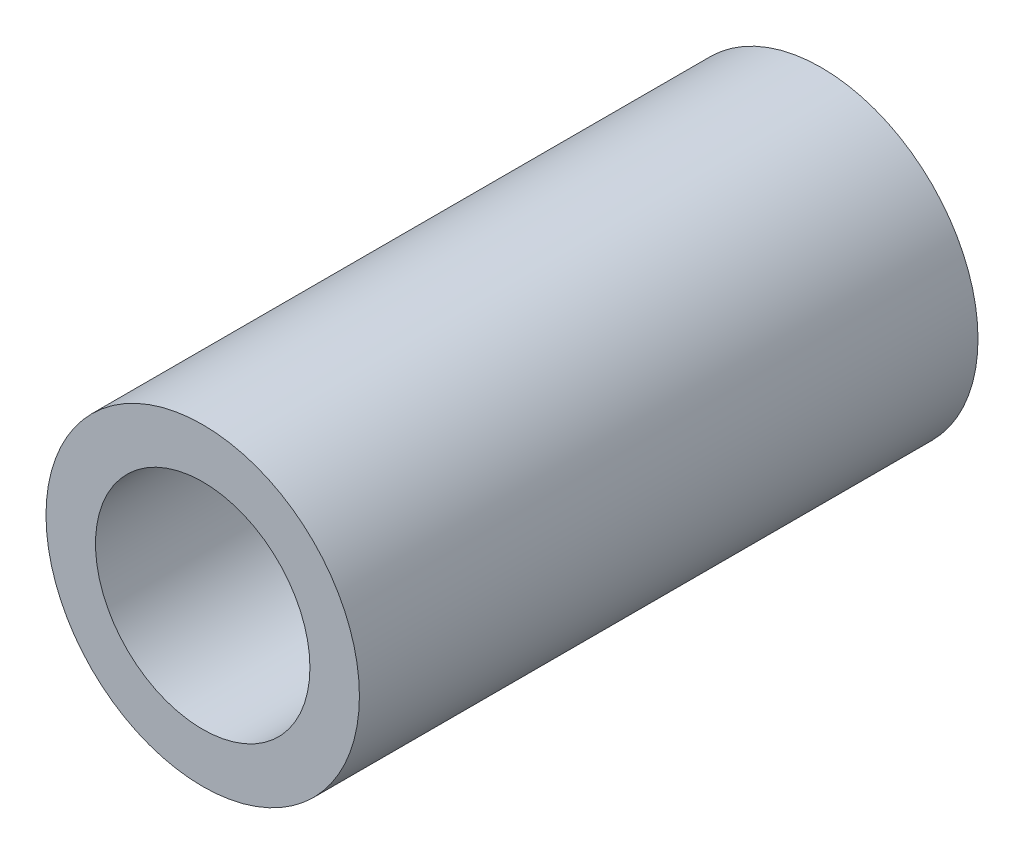
from build123d import *

# Parameters (mm, degrees)
CROQUIS1_R              = 3.8
CROQUIS1_R_2            = 2.6
SALIENTE_EXTRUIR1_DEPTH = 15


with BuildPart() as part:
    # Croquis1 → Saliente-Extruir1 (new body)
    with BuildSketch(Plane.XY):
        with Locations((-72.676772347, 18.238806853)):
            Circle(CROQUIS1_R)
        with Locations((-72.676772347, 18.238806853)):
            Circle(CROQUIS1_R_2, mode=Mode.SUBTRACT)
    extrude(amount=SALIENTE_EXTRUIR1_DEPTH)


solid = part.part
